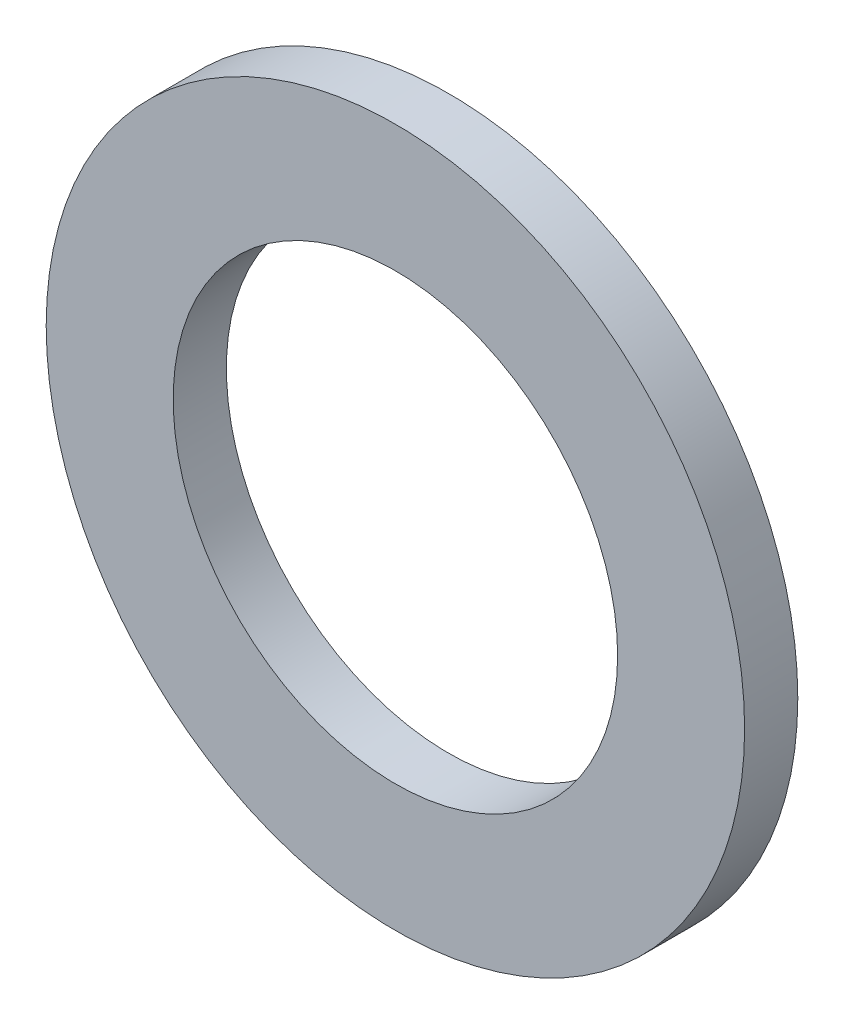
from build123d import *

# Parameters (mm, degrees)
SKETCH1_R           = 22
SKETCH1_R_2         = 14
EXTRUDE_THIN1_DEPTH = 3.35
SCALE1_SCALE        = 0.8


with BuildPart() as part:
    # Sketch1 → Extrude-Thin1 (new body)
    with BuildSketch(Plane.XY):
        Circle(SKETCH1_R)
        Circle(SKETCH1_R_2, mode=Mode.SUBTRACT)
    extrude(amount=EXTRUDE_THIN1_DEPTH)


with BuildPart() as part_1:
    # Scale1: scaled about (0, 0, 1.675)
    add(part.part.scale(SCALE1_SCALE).moved(Location((0, 0, 0.335))))


solid = part_1.part
